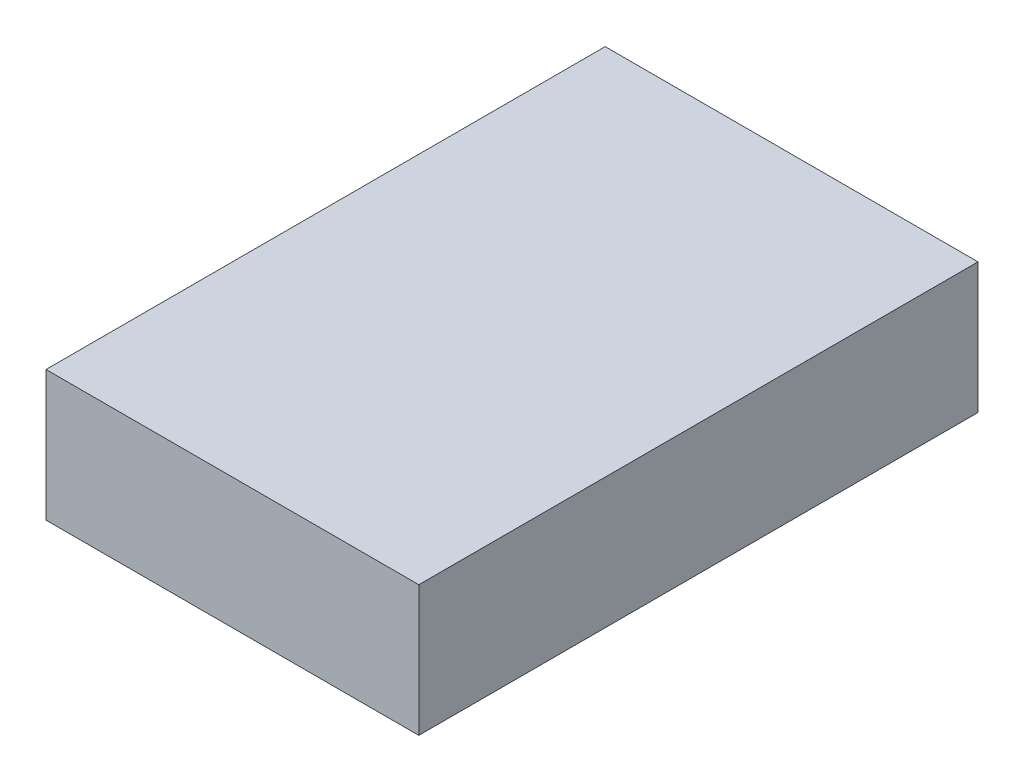
from build123d import *

# Parameters (mm, degrees)
SKETCH1_W           = 200
SKETCH1_H           = 70
BOSS_EXTRUDE1_DEPTH = 300


with BuildPart() as part:
    # Sketch1 → Boss-Extrude1 (new body)
    with BuildSketch(Plane.XY):
        with Locations((100, 35)):
            Rectangle(SKETCH1_W, SKETCH1_H)
    extrude(amount=BOSS_EXTRUDE1_DEPTH)


solid = part.part
